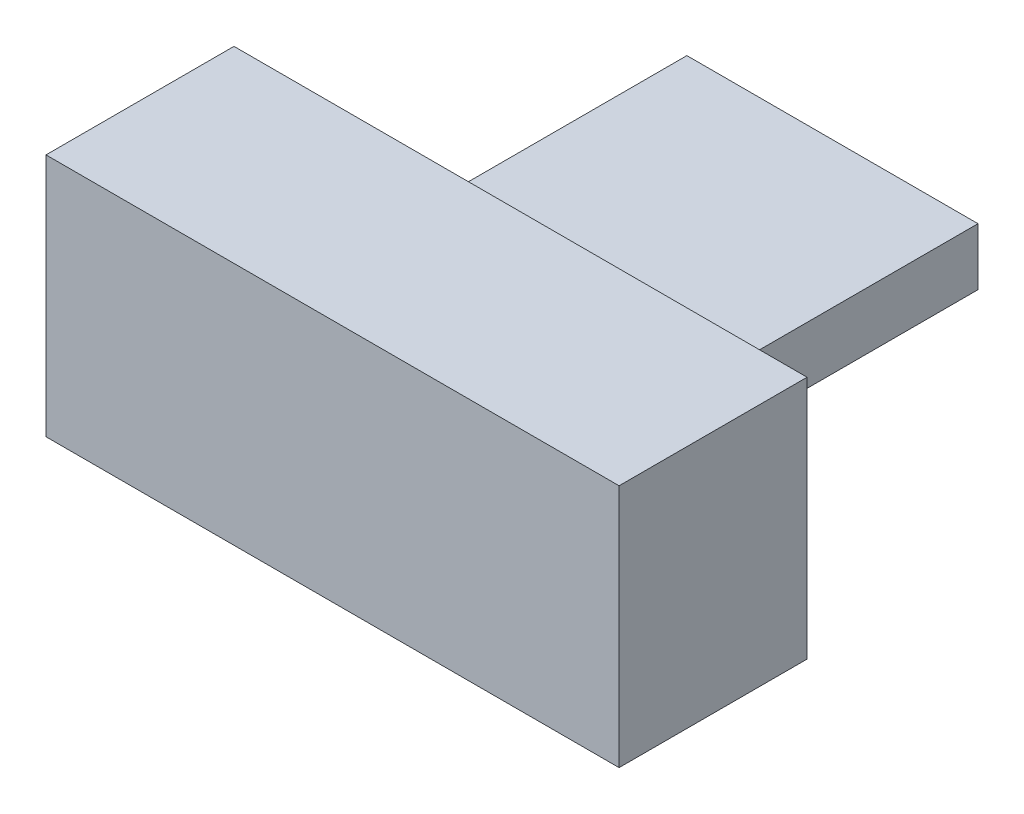
from build123d import *

# Parameters (mm, degrees)
SKETCH1_W           = 70.0024
SKETCH1_H           = 22.9616
BOSS_EXTRUDE1_DEPTH = 14.9098
SKETCH2_W           = 35.56
SKETCH2_H           = 6.985
BOSS_EXTRUDE2_DEPTH = 38.1


with BuildPart() as part:
    # Sketch1 → Boss-Extrude1 (new, symmetric)
    with BuildSketch(Plane(origin=(0, 0, 0), x_dir=(1, 0, 0), z_dir=(0, 1, 0))):
        Rectangle(SKETCH1_W, SKETCH1_H)
    extrude(amount=BOSS_EXTRUDE1_DEPTH, both=True)

    # Sketch2 → Boss-Extrude2 (add)
    with BuildSketch(Plane(origin=(0, 0, -11.4808), x_dir=(-1, 0, 0), z_dir=(0, 0, -1))):
        Rectangle(SKETCH2_W, SKETCH2_H)
    extrude(amount=BOSS_EXTRUDE2_DEPTH)


solid = part.part
